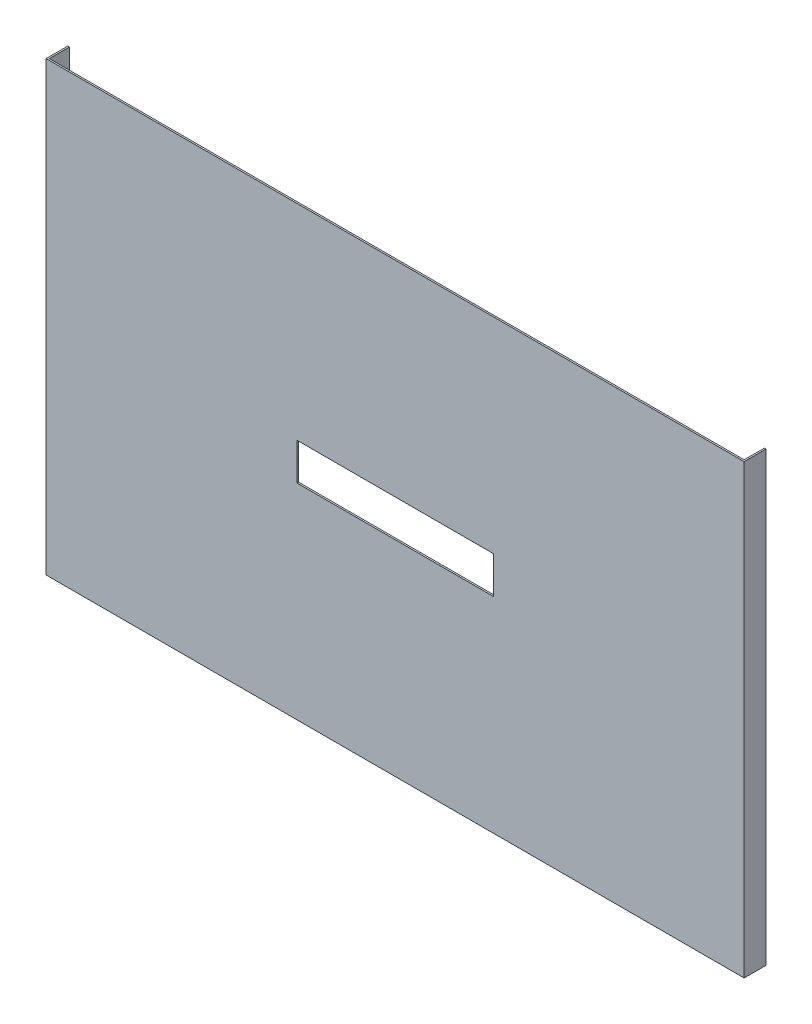
from build123d import *

# Parameters (mm, degrees)
TOPPING_KLAPE_KAT2_KAPAK_1_START = 1150
TOPPING_KLAPE_KAT2_KAPAK_1_DEPTH = 410
TOPPING_KLAPE_KAT2_KAPAK_2_START = 27
SKETCH2_W                        = 180
SKETCH2_H                        = 34
TOPPING_KLAPE_KAT2_KAPAK_2_DEPTH = 14


with BuildPart() as part:
    # Sketch1 → TOPPING_klape_kat2_kapak_1 (new body)
    with BuildSketch(Plane(origin=(0, 0, 0), x_dir=(1, 0, 0), z_dir=(0, 1, 0)).offset(TOPPING_KLAPE_KAT2_KAPAK_1_START)):
        Polygon((30, -40), (30, -20), (31.5, -20), (31.5, -38.5), (668.5, -38.5), (668.5, -20), (670, -20), (670, -40), align=None)
    extrude(amount=TOPPING_KLAPE_KAT2_KAPAK_1_DEPTH)

    # Sketch2 → TOPPING_klape_kat2_kapak_2 (cut)
    with BuildSketch(Plane.XY.offset(TOPPING_KLAPE_KAT2_KAPAK_2_START)):
        with Locations((350, 1355)):
            Rectangle(SKETCH2_W, SKETCH2_H)
    extrude(amount=TOPPING_KLAPE_KAT2_KAPAK_2_DEPTH, mode=Mode.SUBTRACT)


solid = part.part
